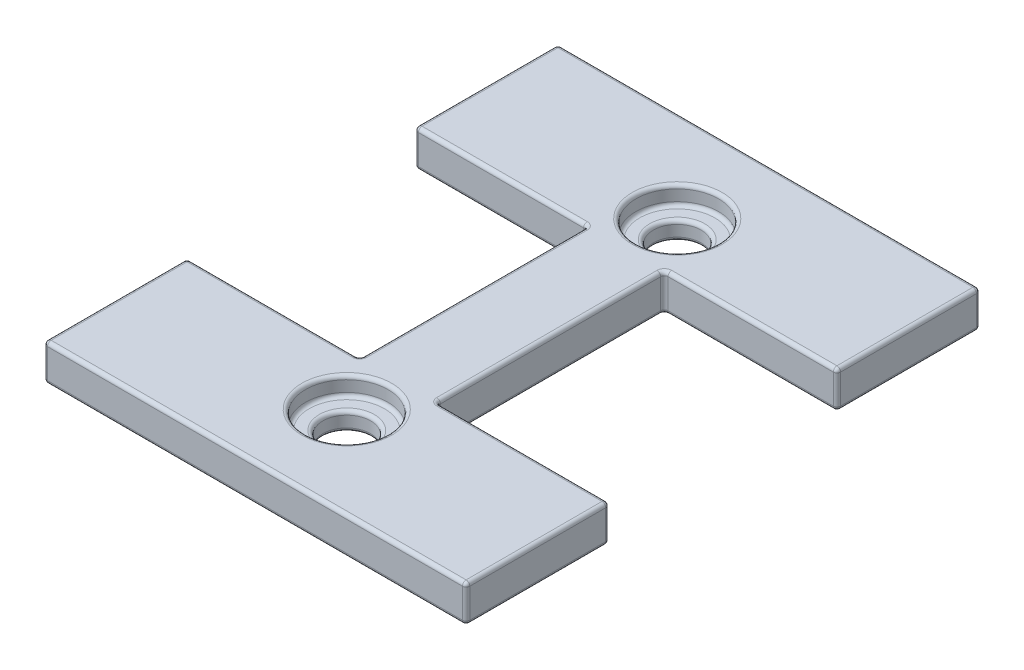
from build123d import *

# Parameters (mm, degrees)
SKETCH1_W           = 11.5
SKETCH1_H           = 14
BOSS_EXTRUDE1_DEPTH = 1
SKETCH2_W           = 8.136741744
SKETCH2_H           = 6.2
SKETCH2_W_2         = 9.166143669
CUT_EXTRUDE1_DEPTH  = 1
SKETCH3_R           = 1.125
CUT_EXTRUDE2_DEPTH  = 0.5
SKETCH4_R           = 0.65
CUT_EXTRUDE3_DEPTH  = 0.5
FILLET1_R           = 0.1


with BuildPart() as part:
    # Sketch1 → Boss-Extrude1 (new body)
    with BuildSketch(Plane(origin=(0, 0, 0), x_dir=(1, 0, 0), z_dir=(0, 1, 0))):
        Rectangle(SKETCH1_W, SKETCH1_H)
    extrude(amount=BOSS_EXTRUDE1_DEPTH)

    # Sketch2 → Cut-Extrude1 (cut)
    with BuildSketch(Plane(origin=(0, 1, 0), x_dir=(1, 0, 0), z_dir=(0, 1, 0))):
        with Locations((-5.118370872, 0)):
            Rectangle(SKETCH2_W, SKETCH2_H)
        with Locations((5.633071835, 0)):
            Rectangle(SKETCH2_W_2, SKETCH2_H)
    extrude(amount=-CUT_EXTRUDE1_DEPTH, mode=Mode.SUBTRACT)

    # Sketch3 → Cut-Extrude2 (cut)
    with BuildSketch(Plane(origin=(0, 1, 0), x_dir=(1, 0, 0), z_dir=(0, 1, 0))):
        with Locations(Location((0, 4.5, 0), (0, 0, 270))):
            Circle(SKETCH3_R)
        with Locations(Location((0, -4.5, 0), (0, 0, 270))):
            Circle(SKETCH3_R)
    extrude(amount=-CUT_EXTRUDE2_DEPTH, mode=Mode.SUBTRACT)

    # Sketch4 → Cut-Extrude3 (cut)
    with BuildSketch(Plane(origin=(0, 0.5, 0), x_dir=(1, 0, 0), z_dir=(0, 1, 0))):
        with Locations(Location((0, 4.5, 0), (0, 0, 270))):
            Circle(SKETCH4_R)
        with Locations(Location((0, -4.5, 0), (0, 0, 270))):
            Circle(SKETCH4_R)
    extrude(amount=-CUT_EXTRUDE3_DEPTH, mode=Mode.SUBTRACT)

    # Fillet1
    fillet1_edges = [part.edges().sort_by_distance(p)[0] for p in [
        (5.75, 1, 5.05),
        (0, 1, -7),
        (-5.75, 0, 5.05),
        (-3.4, 0, 3.1),
        (-5.75, 1, 5.05),
        (-3.4, 1, -3.1),
        (-3.4, 1, 3.1),
        (-1.05, 1, 0),
        (-3.4, 0, -3.1),
        (-5.75, 0.5, -3.1),
        (-5.75, 0.5, 3.1),
        (-1.05, 0.5, 3.1),
        (-1.05, 0, 0),
        (-1.05, 0.5, -3.1),
        (5.75, 0, -5.05),
        (3.4, 0, -3.1),
        (5.75, 1, -5.05),
        (3.4, 1, 3.1),
        (3.4, 1, -3.1),
        (1.05, 1, 0),
        (5.75, 0.5, -3.1),
        (1.05, 0.5, -3.1),
        (3.4, 0, 3.1),
        (5.75, 0.5, 3.1),
        (1.05, 0, 0),
        (1.05, 0.5, 3.1),
        (-5.75, 1, -5.05),
        (0, 0, -7),
        (5.75, 0, 5.05),
        (0, 0, 7),
        (0, 0.5, -5.625),
        (0, 1, -5.625),
        (-5.75, 0, -5.05),
        (0, 0.5, 3.375),
        (0, 1, 3.375),
        (0, 0, -5.15),
        (0, 0.5, -5.15),
        (0, 0, 3.85),
        (0, 0.5, 3.85),
        (0, 1, 7),
        (-5.75, 0.5, -7),
        (5.75, 0.5, -7),
        (5.75, 0.5, 7),
        (-5.75, 0.5, 7),
    ]]
    fillet(fillet1_edges, radius=FILLET1_R)


solid = part.part
